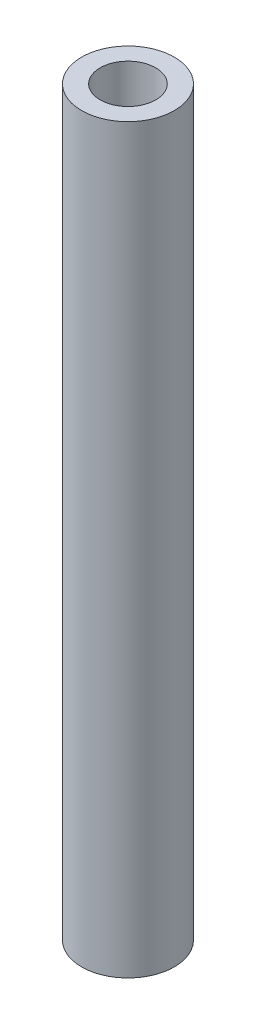
from build123d import *

# Parameters (mm, degrees)
SKETCH_8_R          = 5
EXTRUDE_2_DEPTH     = 80
SKETCH_9_R          = 3
CUT_EXTRUDE_5_DEPTH = 75
SKETCH_12_R         = 1.55
CUT_EXTRUDE_7_DEPTH = 5


with BuildPart() as part:
    # Эскиз8 → Бобышка-Вытянуть2 (new body)
    with BuildSketch(Plane(origin=(0, 0, 0), x_dir=(1, 0, 0), z_dir=(0, 1, 0))):
        with Locations(Location((0, 0, 0), (0, 0, 270))):
            Circle(SKETCH_8_R)
    extrude(amount=EXTRUDE_2_DEPTH)

    # Эскиз9 → Вырез-Вытянуть5 (cut)
    with BuildSketch(Plane(origin=(0, 80, 0), x_dir=(1, 0, 0), z_dir=(0, 1, 0))):
        with Locations(Location((0, 0, 0), (0, 0, 270))):
            Circle(SKETCH_9_R)
    extrude(amount=-CUT_EXTRUDE_5_DEPTH, mode=Mode.SUBTRACT)

    # Эскиз12 → Вырез-Вытянуть7 (cut)
    with BuildSketch(Plane.XZ):
        with Locations(Location((0, 0, 0), (0, 0, 270))):
            Circle(SKETCH_12_R)
    extrude(amount=-CUT_EXTRUDE_7_DEPTH, mode=Mode.SUBTRACT)


solid = part.part
